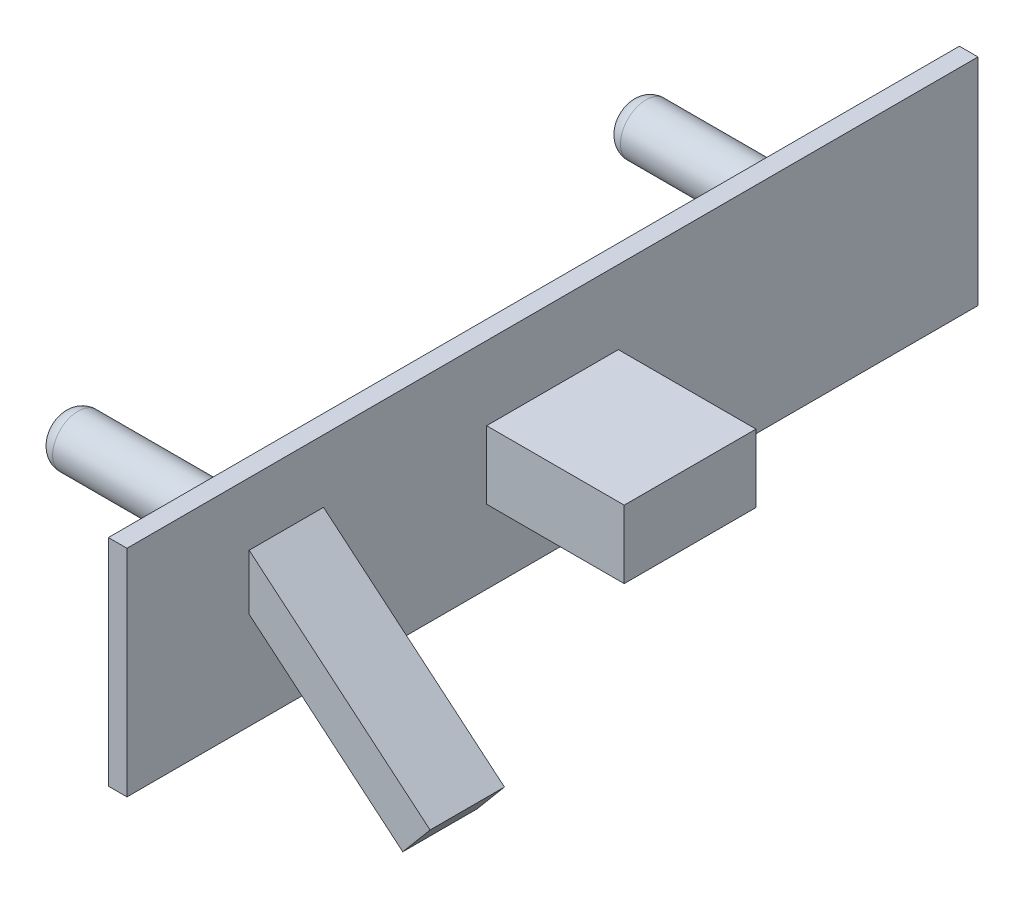
from build123d import *

# Parameters (mm, degrees)
SKETCH1_W                       = 80.1
SKETCH1_H                       = 20.27
SKETCH1_W_2                     = 12.4
SKETCH1_H_2                     = 6.4
BOSS_EXTRUDE1_DEPTH             = 1.75
SKETCH1_2_W                     = 12.4
SKETCH1_2_H                     = 6.4
BOSS_EXTRUDE2_DEPTH             = 14.7
BOSS_EXTRUDE3_REACH             = 85.961
SKETCH2_W                       = 7
SKETCH2_H                       = 4
BOSS_EXTRUDE3_DIRECTION_2_DEPTH = 13
SKETCH3_R                       = 2.4
BOSS_EXTRUDE4_DEPTH             = 18.55
SKETCH3_3_R                     = 2.4
BOSS_EXTRUDE5_DEPTH             = 17.2
FILLET1_R                       = 1.5


with BuildPart() as part:
    # Sketch1 → Boss-Extrude1 (new body)
    with BuildSketch(Plane(origin=(0, 0, 0), x_dir=(0, 0, -1), z_dir=(1, 0, 0))):
        with Locations((40.05, 10.135)):
            Rectangle(SKETCH1_W, SKETCH1_H)
        with Locations((40.05, 10.135)):
            Rectangle(SKETCH1_W_2, SKETCH1_H_2, mode=Mode.SUBTRACT)
    extrude(amount=BOSS_EXTRUDE1_DEPTH)

    # Sketch1<2> → Boss-Extrude2 (add)
    with BuildSketch(Plane(origin=(0, 0, 0), x_dir=(0, 0, -1), z_dir=(1, 0, 0))):
        with Locations((40.05, 10.135)):
            Rectangle(SKETCH1_2_W, SKETCH1_2_H)
    extrude(amount=BOSS_EXTRUDE2_DEPTH)

    # Sketch2 → Boss-Extrude3 (add, up to next)
    with BuildSketch(Plane(origin=(1.026942155, -0.861706784, 0), x_dir=(0, 0, -1), z_dir=(0.7660444431189771, -0.6427876096865406, 0)), mode=Mode.PRIVATE) as boss_extrude3_sk1:
        with Locations((15, 10.124878317)):
            Rectangle(SKETCH2_W, SKETCH2_H)
    boss_extrude3_tool1 = extrude(boss_extrude3_sk1.sketch, amount=-BOSS_EXTRUDE3_REACH, mode=Mode.PRIVATE) - part.part
    add(boss_extrude3_tool1.solids().sort_by_distance((7.535088, 6.8944, -15))[0])

    # Sketch2 → Boss-Extrude3 direction 2 (add)
    with BuildSketch(Plane(origin=(1.026942155, -0.861706784, 0), x_dir=(0, 0, -1), z_dir=(0.7660444431189771, -0.6427876096865406, 0))):
        with Locations((15, 10.124878317)):
            Rectangle(SKETCH2_W, SKETCH2_H)
    extrude(amount=BOSS_EXTRUDE3_DIRECTION_2_DEPTH)

    # Sketch3 → Boss-Extrude4 (add)
    with BuildSketch(Plane.ZY):
        with Locations((-14.2, 12.55)):
            Circle(SKETCH3_R)
    extrude(amount=BOSS_EXTRUDE4_DEPTH)

    # Sketch3<3> → Boss-Extrude5 (add)
    with BuildSketch(Plane.ZY):
        with Locations((-66.3, 12.55)):
            Circle(SKETCH3_3_R)
    extrude(amount=BOSS_EXTRUDE5_DEPTH)

    # Fillet1
    fillet1_edges = [part.edges().sort_by_distance(p)[0] for p in [
        (-17.2, 12.55, -68.7),
        (-18.55, 12.55, -16.6),
    ]]
    fillet(fillet1_edges, radius=FILLET1_R)


solid = part.part
